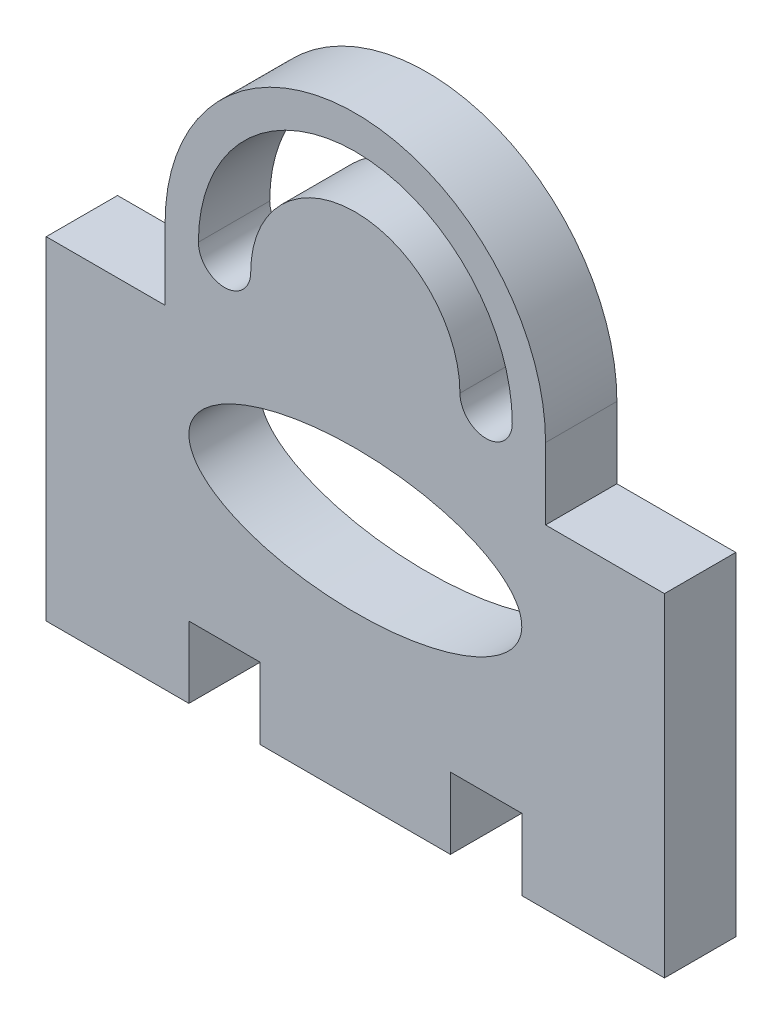
from build123d import *

# Parameters (mm, degrees)
SKETCH1_RX          = 70
SKETCH1_RY          = 30
BOSS_EXTRUDE1_DEPTH = 30


with BuildPart() as part:
    # Sketch1 → Boss-Extrude1 (new body)
    with BuildSketch(Plane.XY):
        with BuildLine():
            Line((130, -70), (70, -70))
            Line((70, -70), (70, -40))
            Line((70, -40), (40, -40))
            Line((40, -40), (40, -70))
            Line((40, -70), (-40, -70))
            Line((-40, -70), (-40, -40))
            Line((-40, -40), (-70, -40))
            Line((-70, -40), (-70, -70))
            Line((-70, -70), (-130, -70))
            Line((-130, -70), (-130, 70))
            Line((-130, 70), (-80, 70))
            Line((-80, 70), (-80, 100))
            ThreePointArc((-80, 100), (0, 180), (80, 100))
            Line((80, 100), (80, 70))
            Line((80, 70), (130, 70))
            Line((130, 70), (130, -70))
        make_face()
        with Locations(Location((0, 28.005273926), (0, 0, -180))):
            Ellipse(SKETCH1_RX, SKETCH1_RY, mode=Mode.SUBTRACT)
        with BuildLine():
            ThreePointArc((66, 100), (0, 166), (-66, 100))
            ThreePointArc((-66, 100), (-55, 89), (-44, 100))
            ThreePointArc((-44, 100), (0, 144), (44, 100))
            ThreePointArc((44, 100), (55, 89), (66, 100))
        make_face(mode=Mode.SUBTRACT)
    extrude(amount=BOSS_EXTRUDE1_DEPTH)


solid = part.part
